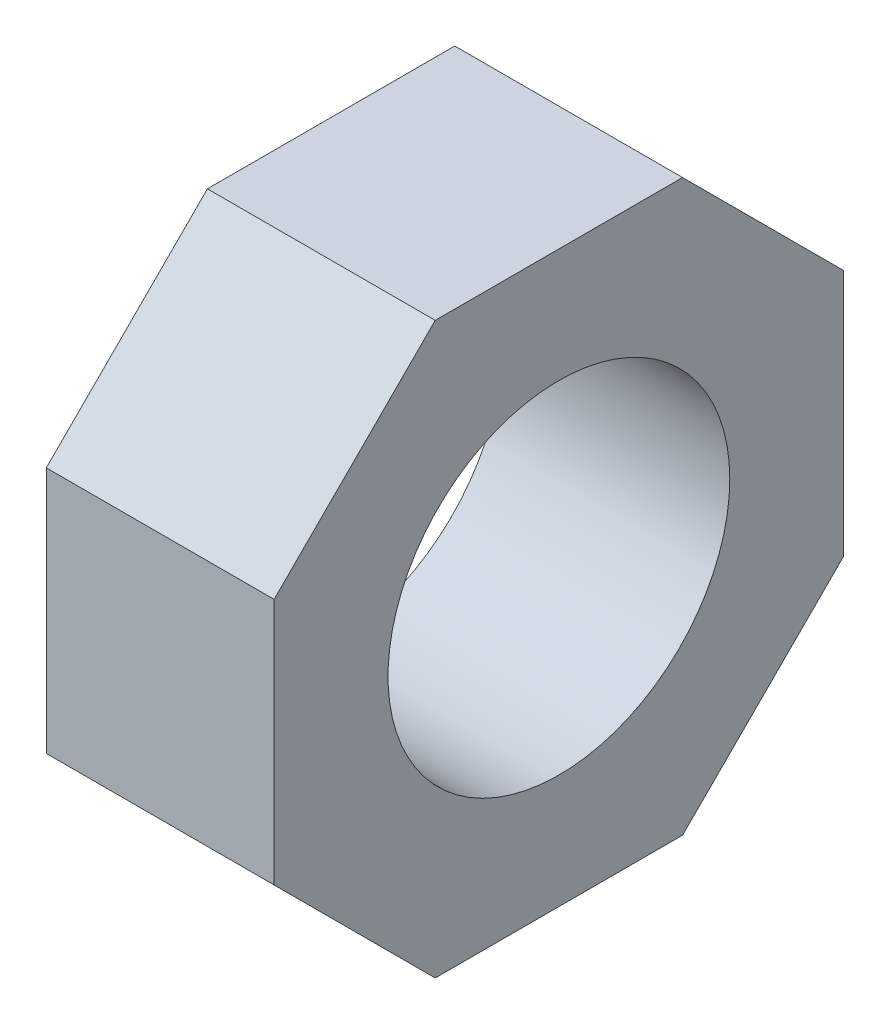
from build123d import *

# Parameters (mm, degrees)
SKETCH1_R           = 1.5
BOSS_EXTRUDE1_DEPTH = 2


with BuildPart() as part:
    # Sketch1 → Boss-Extrude1 (new body)
    with BuildSketch(Plane(origin=(0, 0, 0), x_dir=(0, 0, -1), z_dir=(1, 0, 0))):
        Polygon((-1.085786438, 2.5), (1.085786438, 2.5), (2.5, 1.085786438), (2.5, -1.085786438), (1.085786438, -2.5), (-1.085786438, -2.5), (-2.5, -1.085786438), (-2.5, 1.085786438), align=None)
        Circle(SKETCH1_R, mode=Mode.SUBTRACT)
    extrude(amount=BOSS_EXTRUDE1_DEPTH)


solid = part.part
